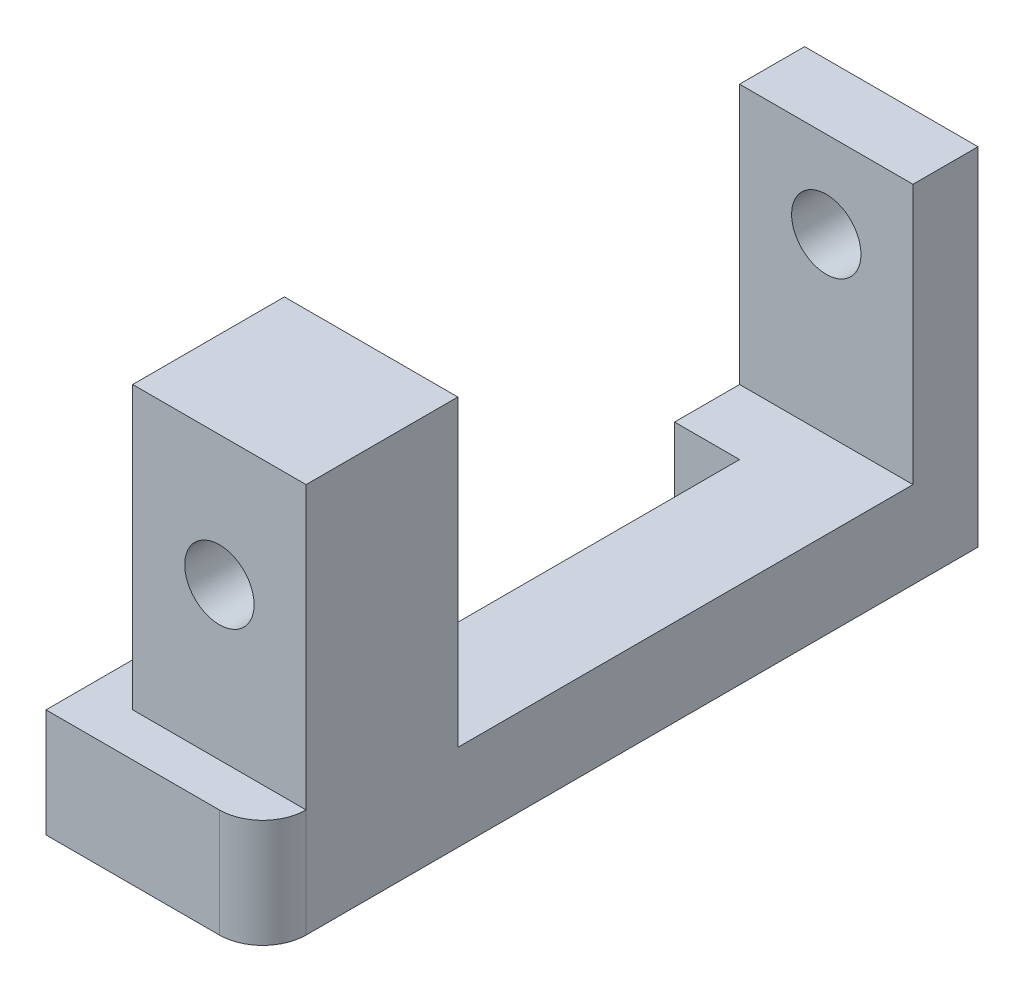
from build123d import *

# Parameters (mm, degrees)
BOSS_EXTRUDE1_DEPTH       = 8
CUT_EXTRUDE2_DEPTH        = 21
BOSS_EXTRUDE2_DEPTH       = 3
BOSS_EXTRUDE5_DEPTH       = 5
SKETCH6_R                 = 1.6
CUT_EXTRUDE3_DEPTH        = 38.215588132
F_3_0MM_DOWEL_HOLE1_D     = 3
F_3_0MM_DOWEL_HOLE1_DEPTH = 5
F_3_0MM_DOWEL_HOLE1_TIP   = 0.901290929


with BuildPart() as part:
    # Sketch1 → Boss-Extrude1 (new body)
    with BuildSketch(Plane(origin=(0, 0, 0), x_dir=(0, 0, -1), z_dir=(1, 0, 0))):
        Polygon((0, 0), (0, 16), (-3, 16), (-3, 4), (-24, 4), (-24, 18), (-31, 18), (-31, 0), align=None)
    extrude(amount=-BOSS_EXTRUDE1_DEPTH)

    # Sketch5 → Cut-Extrude2 (cut)
    with BuildSketch(Plane.XY.offset(3)):
        Polygon((-8, 0), (-3, 0), (-5, 4), (-8, 4), align=None)
    extrude(amount=CUT_EXTRUDE2_DEPTH, mode=Mode.SUBTRACT)

    # Sketch8 → Boss-Extrude2 (add)
    with BuildSketch(Plane.XY.offset(3)):
        Polygon((-8, 4), (-5, 4), (-3, 0), (-8, 0), align=None)
    extrude(amount=BOSS_EXTRUDE2_DEPTH)

    # Sketch11 → Boss-Extrude5 (add)
    with BuildSketch(Plane.XZ):
        with BuildLine():
            Line((-10, 26), (-10, 33))
            Line((-10, 33), (-2, 33))
            ThreePointArc((-2, 33), (-0.585786438, 32.414213562), (0, 31))
            Line((0, 31), (-8, 31))
            Line((-8, 31), (-8, 24))
            ThreePointArc((-8, 24), (-9.414213562, 24.585786438), (-10, 26))
        make_face()
    extrude(amount=-BOSS_EXTRUDE5_DEPTH)

    # Sketch6 → Cut-Extrude3 (cut, through all)
    with BuildSketch(Plane.XY.offset(31)):
        with Locations((-4, 12)):
            Circle(SKETCH6_R)
    extrude(amount=-CUT_EXTRUDE3_DEPTH, mode=Mode.SUBTRACT)

    # Ø3.0mm Dowel Hole1
    with Locations(Plane(origin=(0, 0, 0), x_dir=(-1, 0, 0), z_dir=(0, -1, 0))):
        with Locations((5.715, -29)):
            Hole(F_3_0MM_DOWEL_HOLE1_D / 2, depth=F_3_0MM_DOWEL_HOLE1_DEPTH)
            with Locations((0, 0, -(F_3_0MM_DOWEL_HOLE1_DEPTH + F_3_0MM_DOWEL_HOLE1_TIP / 2))):  # 118° drill point
                Cone(0, F_3_0MM_DOWEL_HOLE1_D / 2, F_3_0MM_DOWEL_HOLE1_TIP, mode=Mode.SUBTRACT)


solid = part.part
